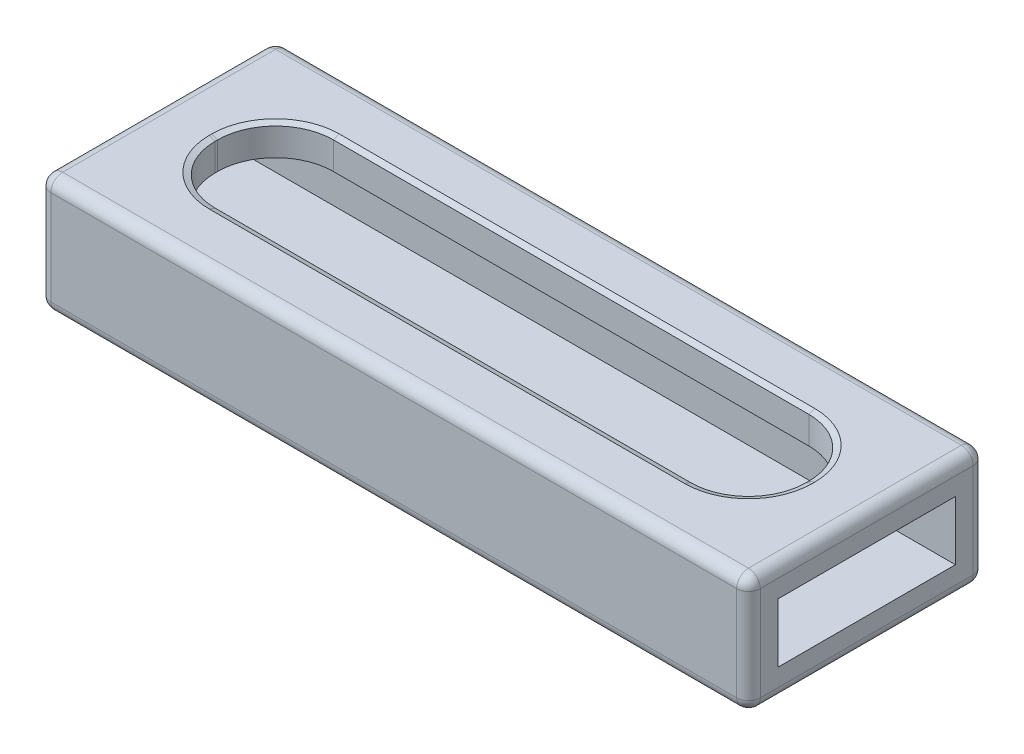
from build123d import *

# Parameters (mm, degrees)
SKETCH1_W           = 76.2
SKETCH1_H           = 25.4
BOSS_EXTRUDE1_DEPTH = 12.7
SKETCH2_W           = 19.05
SKETCH2_H           = 6.35
CUT_EXTRUDE1_DEPTH  = 82.319677815
CUT_EXTRUDE2_DEPTH  = 3.175
FILLET1_R           = 1.27
CHAMFER1_SIZE       = 0.635
CHAMFER1_SIZE2      = 0.231121099


with BuildPart() as part:
    # Sketch1 → Boss-Extrude1 (new body)
    with BuildSketch(Plane(origin=(0, 0, 0), x_dir=(1, 0, 0), z_dir=(0, 1, 0))):
        with Locations((38.1, 12.7)):
            Rectangle(SKETCH1_W, SKETCH1_H)
    extrude(amount=BOSS_EXTRUDE1_DEPTH)

    # Sketch2 → Cut-Extrude1 (cut, through all)
    with BuildSketch(Plane(origin=(76.2, 0, 0), x_dir=(0, 0, -1), z_dir=(1, 0, 0))):
        with Locations((12.7, 6.35)):
            Rectangle(SKETCH2_W, SKETCH2_H)
    extrude(amount=-CUT_EXTRUDE1_DEPTH, mode=Mode.SUBTRACT)

    # Sketch3 → Cut-Extrude2 (cut)
    with BuildSketch(Plane(origin=(0, 12.7, 0), x_dir=(1, 0, 0), z_dir=(0, 1, 0))):
        with BuildLine():
            Line((12.573, 6.35), (63.627, 6.35))
            ThreePointArc((63.627, 6.35), (68.027325499, 8.172674501), (69.85, 12.573))
            Line((69.85, 12.573), (69.85, 12.827))
            ThreePointArc((69.85, 12.827), (68.027325499, 17.227325499), (63.627, 19.05))
            Line((63.627, 19.05), (12.573, 19.05))
            ThreePointArc((12.573, 19.05), (8.172674501, 17.227325499), (6.35, 12.827))
            Line((6.35, 12.827), (6.35, 12.573))
            ThreePointArc((6.35, 12.573), (8.172674501, 8.172674501), (12.573, 6.35))
        make_face()
    extrude(amount=-CUT_EXTRUDE2_DEPTH, mode=Mode.SUBTRACT)

    # Fillet1
    fillet1_edges = [part.edges().sort_by_distance(p)[0] for p in [
        (76.2, 12.7, -12.7),
        (38.1, 12.7, -25.4),
        (0, 12.7, -12.7),
        (38.1, 0, -25.4),
        (76.2, 0, -12.7),
        (38.1, 0, 0),
        (0, 0, -12.7),
        (0, 6.35, -25.4),
        (76.2, 6.35, -25.4),
        (76.2, 6.35, 0),
        (0, 6.35, 0),
        (38.1, 12.7, 0),
    ]]
    fillet(fillet1_edges, radius=FILLET1_R)

    # Chamfer1
    chamfer1_edges = [part.edges().sort_by_distance(p)[0] for p in [
        (68.027325499, 12.7, -17.227325499),
        (38.1, 12.7, -19.05),
        (8.172674501, 12.7, -17.227325499),
        (6.35, 12.7, -12.7),
        (8.172674501, 12.7, -8.172674501),
        (38.1, 12.7, -6.35),
        (68.027325499, 12.7, -8.172674501),
        (69.85, 12.7, -12.7),
    ]]
    chamfer1_side = [part.faces().sort_by_distance(p)[0] for p in [
        (74.158742896, 12.7, -12.7),
    ]]
    chamfer(chamfer1_edges, length=CHAMFER1_SIZE, length2=CHAMFER1_SIZE2, reference=chamfer1_side[0])


solid = part.part
